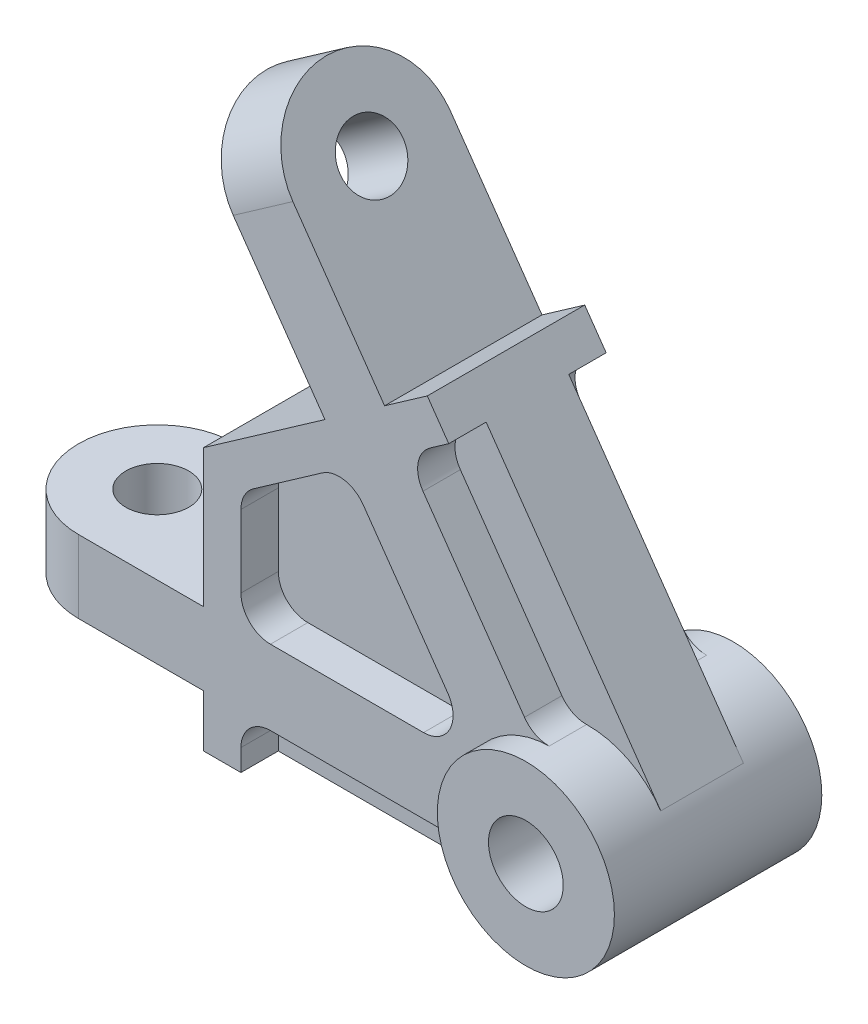
from build123d import *
from build123d.topology import SkipClean

# Parameters (mm, degrees)
SKETCH2_R            = 8
BOSS_EXTRUDE1_DEPTH  = 9.25
SKETCH3_R            = 8
BOSS_EXTRUDE2_DEPTH  = 9.25
SKETCH5_R            = 22.5
BOSS_EXTRUDE3_DEPTH  = 20
SKETCH6_R            = 9.5
CUT_EXTRUDE1_DEPTH   = 20
CUT_EXTRUDE3_DEPTH   = 9.5
FILLET1_R            = 7.5
FILLET1_OF_MIRROR1_R = 7.5
SKETCH9_R            = 22.5
SKETCH9_R_2          = 9.5
BOSS_EXTRUDE5_DEPTH  = 6.35


with BuildPart() as part:
    # Sketch2 → Boss-Extrude1 (new, symmetric)
    with BuildSketch(Plane(origin=(0, 0, 0), x_dir=(1, 0, 0), z_dir=(0, 1, 0))):
        with BuildLine():
            Line((0, -20), (-120, -20))
            ThreePointArc((-120, -20), (-140, 0), (-120, 20))
            Line((-120, 20), (0, 20))
            Line((0, 20), (0, -20))
        make_face()
        with Locations(Location((-120, 0, 0), (0, 0, 270))):
            Circle(SKETCH2_R, mode=Mode.SUBTRACT)
    extrude(amount=BOSS_EXTRUDE1_DEPTH, both=True)

    # Sketch3 → Boss-Extrude2 (add, symmetric)
    with BuildSketch(Plane(origin=(0, 0, 0), x_dir=(0.5735764363510444, -0.819152044288993, 0), z_dir=(0.819152044288993, 0.5735764363510444, 0))):
        with BuildLine():
            Line((0, -20), (-127.5, -20))
            ThreePointArc((-127.5, -20), (-147.5, 0), (-127.5, 20))
            Line((-127.5, 20), (0, 20))
            Line((0, 20), (0, -20))
        make_face()
        with Locations(Location((-127.5, 0, 0), (0, 0, 180))):
            Circle(SKETCH3_R, mode=Mode.SUBTRACT)
    extrude(amount=BOSS_EXTRUDE2_DEPTH, both=True)

    # Sketch5 → Boss-Extrude3 (add, symmetric)
    with BuildSketch(Plane.XY):
        with BuildLine():
            Line((-88.25, -22.5), (0, -22.5))
            ThreePointArc((0, -22.5), (-19.957743747, 10.389343798), (18.430920997, 12.905469818))
            Line((18.430920997, 12.905469818), (-31.393139414, 84.061602381))
            Line((-31.393139414, 84.061602381), (-88.25, 44.25))
            Line((-88.25, 44.25), (-88.25, -22.5))
        make_face()
        Circle(SKETCH5_R)
    extrude(amount=BOSS_EXTRUDE3_DEPTH, both=True)

    # Sketch6 → Cut-Extrude1 (cut, symmetric)
    with BuildSketch(Plane.XY):
        Circle(SKETCH6_R)
    extrude(amount=CUT_EXTRUDE1_DEPTH, both=True, mode=Mode.SUBTRACT)

    # Sketch7 → Cut-Extrude3 (cut)
    with BuildSketch(Plane.XY.offset(20)):
        with BuildLine():
            Line((-78.75, -22.5), (0, -22.5))
            ThreePointArc((0, -22.5), (-12.093386622, -18.973665961), (-20.396078054, -9.5))
            Line((-20.396078054, -9.5), (-78.75, -9.5))
            Line((-78.75, -9.5), (-78.75, -22.5))
        make_face()
        with BuildLine():
            Line((-25.944163269, 76.27965796), (-36.797927856, 68.679770179))
            Line((-36.797927856, 68.679770179), (-4.187279424, 22.106937622))
            ThreePointArc((-4.187279424, 22.106937622), (8.47862511, 20.841375105), (18.430920997, 12.905469818))
            Line((18.430920997, 12.905469818), (-25.944163269, 76.27965796))
        make_face()
        Polygon((-17.944136559, 9.5), (-51.952240675, 58.068606106), (-78.75, 39.30461302), (-78.75, 9.5), align=None)
    cut_extrude3 = extrude(amount=-CUT_EXTRUDE3_DEPTH, mode=Mode.SUBTRACT)

    # Fillet1
    fillet1_edges = [part.edges().sort_by_distance(p)[0] for p in [
        (-20.396078054, -9.5, 15.25),
        (-78.75, -9.5, 15.25),
        (-78.75, 39.30461302, 15.25),
        (-51.952240675, 58.068606106, 15.25),
        (-17.944136559, 9.5, 15.25),
        (-78.75, 9.5, 15.25),
        (-4.187279424, 22.106937622, 15.25),
        (-36.797927856, 68.679770179, 15.25),
    ]]
    fillet(fillet1_edges, radius=FILLET1_R)

    # Mirror1: Cut-Extrude3 across plane
    add(cut_extrude3.mirror(Plane.XY), mode=Mode.SUBTRACT)

    # Fillet1 of Mirror1
    fillet1_of_mirror1_edges = [part.edges().sort_by_distance(p)[0] for p in [
        (-20.396078054, -9.5, -15.25),
        (-78.75, -9.5, -15.25),
        (-78.75, 39.30461302, -15.25),
        (-51.952240675, 58.068606106, -15.25),
        (-17.944136559, 9.5, -15.25),
        (-78.75, 9.5, -15.25),
        (-4.187279424, 22.106937622, -15.25),
        (-36.797927856, 68.679770179, -15.25),
    ]]
    fillet(fillet1_of_mirror1_edges, radius=FILLET1_OF_MIRROR1_R)

    # Sketch9 → Boss-Extrude5 (add)
    with SkipClean():  # the faces are left unmerged after this step: merging them gives an invalid solid
        with BuildSketch(Plane.XY.offset(20)):
            with Locations(Location((0, 0, 0), (0, 0, 214.518107841))):
                Circle(SKETCH9_R)
            Circle(SKETCH9_R_2, mode=Mode.SUBTRACT)
        boss_extrude5 = extrude(amount=BOSS_EXTRUDE5_DEPTH)

    # Mirror2: Boss-Extrude5 across plane
    with SkipClean():  # the faces are left unmerged after this step: merging them gives an invalid solid
        add(boss_extrude5.mirror(Plane.XY))


solid = part.part
